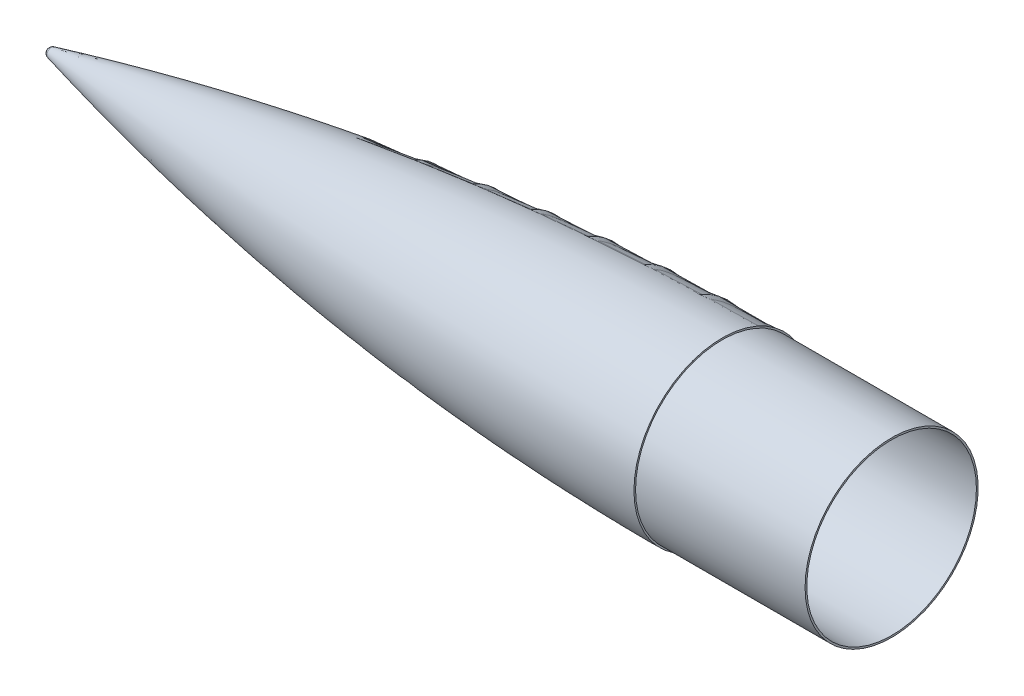
from build123d import *

# Parameters (mm, degrees)
SHELL2_T = -1.524


with BuildPart() as part:
    # Sketch2 → Revolve2 (revolve)
    with BuildSketch(Plane.XY):
        with BuildLine():
            Line((755.456959999, 76.2), (606.231959999, 76.2))
            Line((606.231959999, 76.2), (606.231959999, 77.6224))
            add(Edge.make_bspline(
                [(15.824526301, 3.999479033), (311.02824315, 77.6224), (606.231959999, 77.6224)],
                knots=[0.103403303, 0.103403303, 0.103403303, 0.916509985, 0.916509985, 0.916509985], degree=2))
            ThreePointArc((15.824526301, 3.999479033), (13.57373394, 2.537641481), (12.7, 0))
            Line((12.7, 0), (755.456959999, 0))
            Line((755.456959999, 0), (755.456959999, 76.2))
        make_face()
    revolve(axis=Axis((0, 0, 0), (1, 0, 0)))

    # Shell2
    shell2_openings = [part.faces().sort_by_distance(p)[0] for p in [
        (755.456959999, 0, 0),
    ]]
    offset(amount=SHELL2_T, openings=shell2_openings, kind=Kind.INTERSECTION)


solid = part.part
